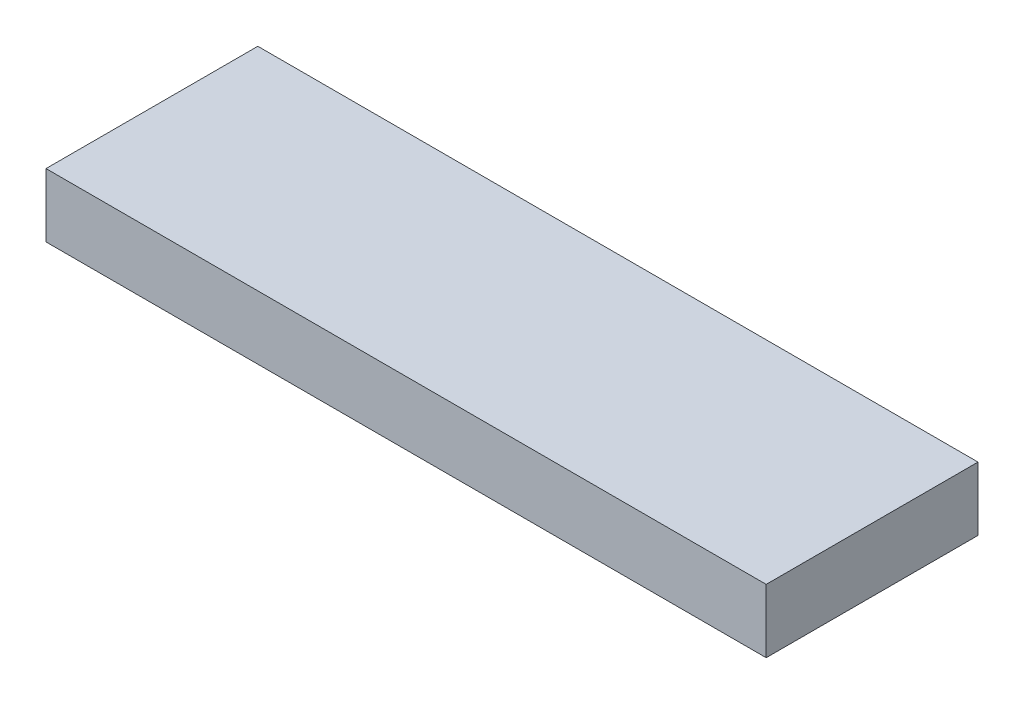
from build123d import *

# Parameters (mm, degrees)
SKETCH_1_W      = 34
SKETCH_1_H      = 10
EXTRUDE_1_DEPTH = 3


with BuildPart() as part:
    # 草图1 → 凸台-拉伸1 (new body)
    with BuildSketch(Plane(origin=(0, 0, 0), x_dir=(1, 0, 0), z_dir=(0, 1, 0))):
        Rectangle(SKETCH_1_W, SKETCH_1_H)
    extrude(amount=EXTRUDE_1_DEPTH)


solid = part.part
